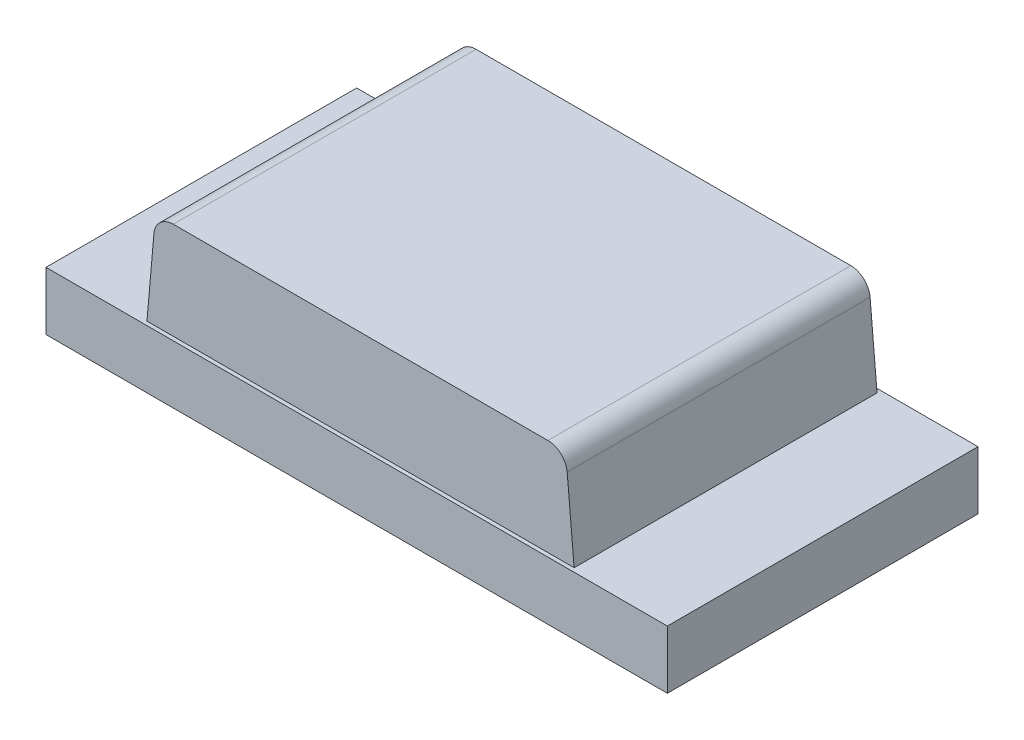
from build123d import *

# Parameters (mm, degrees)
SKETCH1_W       = 1.6
SKETCH1_H       = 0.8
BASE_DEPTH      = 0.15
LENS_DEPTH      = 0.39
LENS_DEPTH_BACK = 0.39
LENS_ROUNDS_R   = 0.05


with BuildPart() as part:
    # Sketch1 → Base (new body)
    with BuildSketch(Plane(origin=(0, 0, 0), x_dir=(1, 0, 0), z_dir=(0, 1, 0))):
        Rectangle(SKETCH1_W, SKETCH1_H)
    extrude(amount=BASE_DEPTH)

    # Sketch2 → Lens (add, two sides: drawn at the far end of the back side and taken through both)
    with BuildSketch(Plane.XY.offset(-LENS_DEPTH_BACK)):
        Polygon((-0.55, 0.15), (-0.528127834, 0.4), (0.528127834, 0.4), (0.55, 0.15), align=None)
    extrude(amount=LENS_DEPTH + LENS_DEPTH_BACK)

    # Lens Rounds
    lens_rounds_edges = [part.edges().sort_by_distance(p)[0] for p in [
        (-0.528127834, 0.4, 0),
        (0.528127834, 0.4, 0),
    ]]
    fillet(lens_rounds_edges, radius=LENS_ROUNDS_R)


solid = part.part
